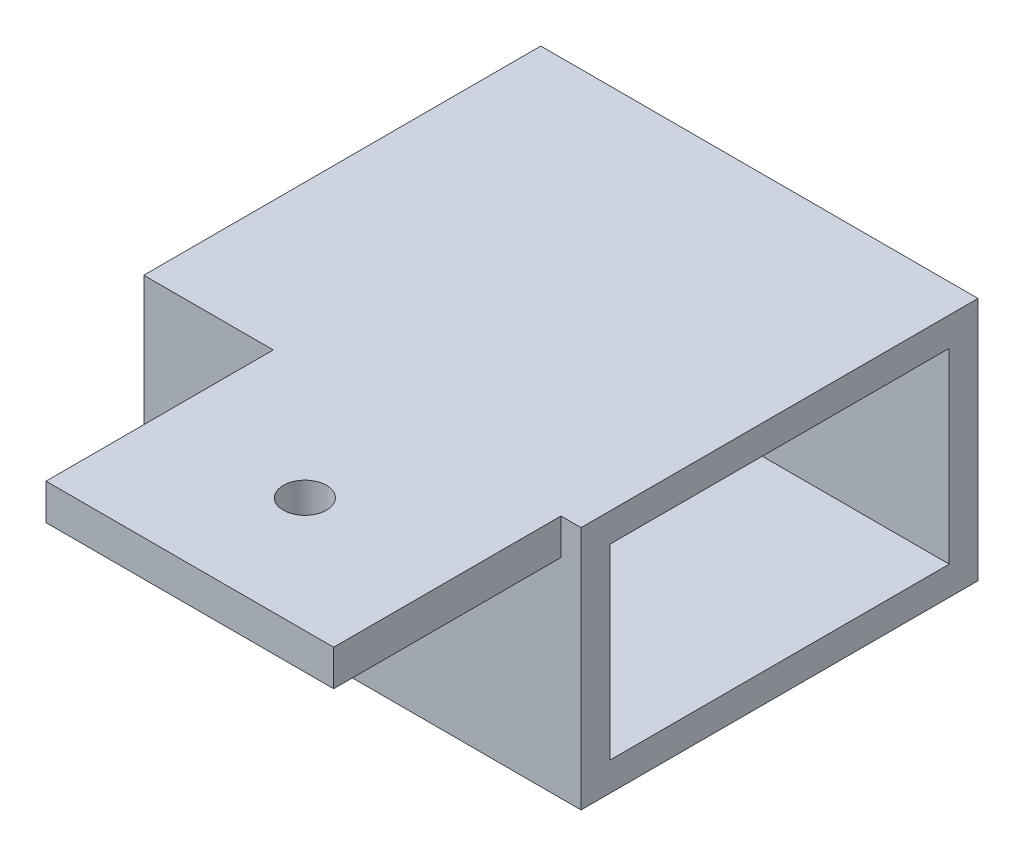
from build123d import *

# Parameters (mm, degrees)
S_BOX1_W       = 20
S_BOX1_H       = 2.5
BOSS_1_DEPTH   = 42
S_BOX2_W       = 30.4
S_BOX2_H       = 17
BOSS_2_DEPTH   = 27.6
S_CUT3_W       = 30.6
S_CUT3_H       = 13
POCKET_3_DEPTH = 23.6
S_HOLE4_R      = 1.5
HOLE_4_DEPTH   = 2.7


with BuildPart() as part:
    # S_box1 → Boss_1 (new body)
    with BuildSketch(Plane.XY.offset(-34)):
        with Locations((0, -2.75)):
            Rectangle(S_BOX1_W, S_BOX1_H)
    extrude(amount=BOSS_1_DEPTH)

    # S_box2 → Boss_2 (add)
    with BuildSketch(Plane.XY.offset(-35.4)):
        with Locations((-3.8, -10)):
            Rectangle(S_BOX2_W, S_BOX2_H)
    extrude(amount=BOSS_2_DEPTH)

    # S_cut3 → Pocket_3 (cut)
    with BuildSketch(Plane.XY.offset(-33.4)):
        with Locations((-3.8, -10)):
            Rectangle(S_CUT3_W, S_CUT3_H)
    extrude(amount=POCKET_3_DEPTH, mode=Mode.SUBTRACT)

    # S_hole4 → Hole_4 (cut)
    with BuildSketch(Plane(origin=(0, -4.1, 0), x_dir=(1, 0, 0), z_dir=(0, 1, 0))):
        with Locations(Location((0, 0, 0), (0, 0, 90))):
            Circle(S_HOLE4_R)
    extrude(amount=HOLE_4_DEPTH, mode=Mode.SUBTRACT)


solid = part.part
